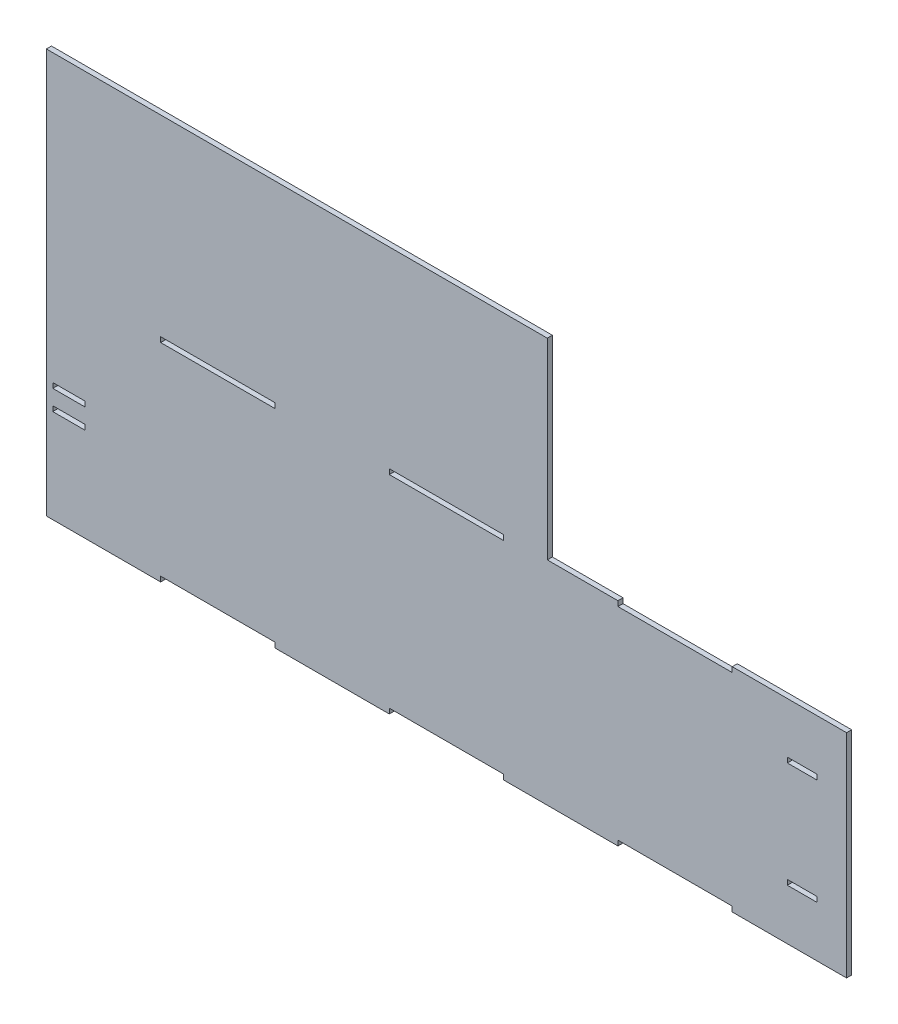
from build123d import *

# Parameters (mm, degrees)
SKETCH1_W           = 71.428571428
SKETCH1_H           = 3.175
SKETCH1_W_2         = 20
SKETCH1_W_3         = 18.5
BOSS_EXTRUDE1_DEPTH = 3.175


with BuildPart() as part:
    # Sketch1 → Boss-Extrude1 (new body)
    with BuildSketch(Plane.XY):
        Polygon((0, 0), (0, 132.75), (0, 252.75), (278.222222222, 252.75), (313, 252.75), (313, 228.115), (313, 132.75), (357.142857143, 132.75), (357.142857143, 129.575), (428.571428571, 129.575), (428.571428571, 132.75), (500, 132.75), (500, 0), (428.571428571, 0), (428.571428571, 3.175), (357.142857143, 3.175), (357.142857143, 0), (285.714285714, 0), (285.714285714, 3.175), (214.285714286, 3.175), (214.285714286, 0), (142.857142857, 0), (142.857142857, 3.175), (71.428571429, 3.175), (71.428571429, 0), align=None)
        with Locations((107.142857143, 131.1625)):
            Rectangle(SKETCH1_W, SKETCH1_H, mode=Mode.SUBTRACT)
        with Locations((250, 131.1625)):
            Rectangle(SKETCH1_W, SKETCH1_H, mode=Mode.SUBTRACT)
        with Locations((14, 60.0875)):
            Rectangle(SKETCH1_W_2, SKETCH1_H, mode=Mode.SUBTRACT)
        with Locations((14, 72.6625)):
            Rectangle(SKETCH1_W_2, SKETCH1_H, mode=Mode.SUBTRACT)
        with Locations((472.25, 33.2875)):
            Rectangle(SKETCH1_W_3, SKETCH1_H, mode=Mode.SUBTRACT)
        with Locations((472.25, 99.4625)):
            Rectangle(SKETCH1_W_3, SKETCH1_H, mode=Mode.SUBTRACT)
    extrude(amount=BOSS_EXTRUDE1_DEPTH)


solid = part.part
